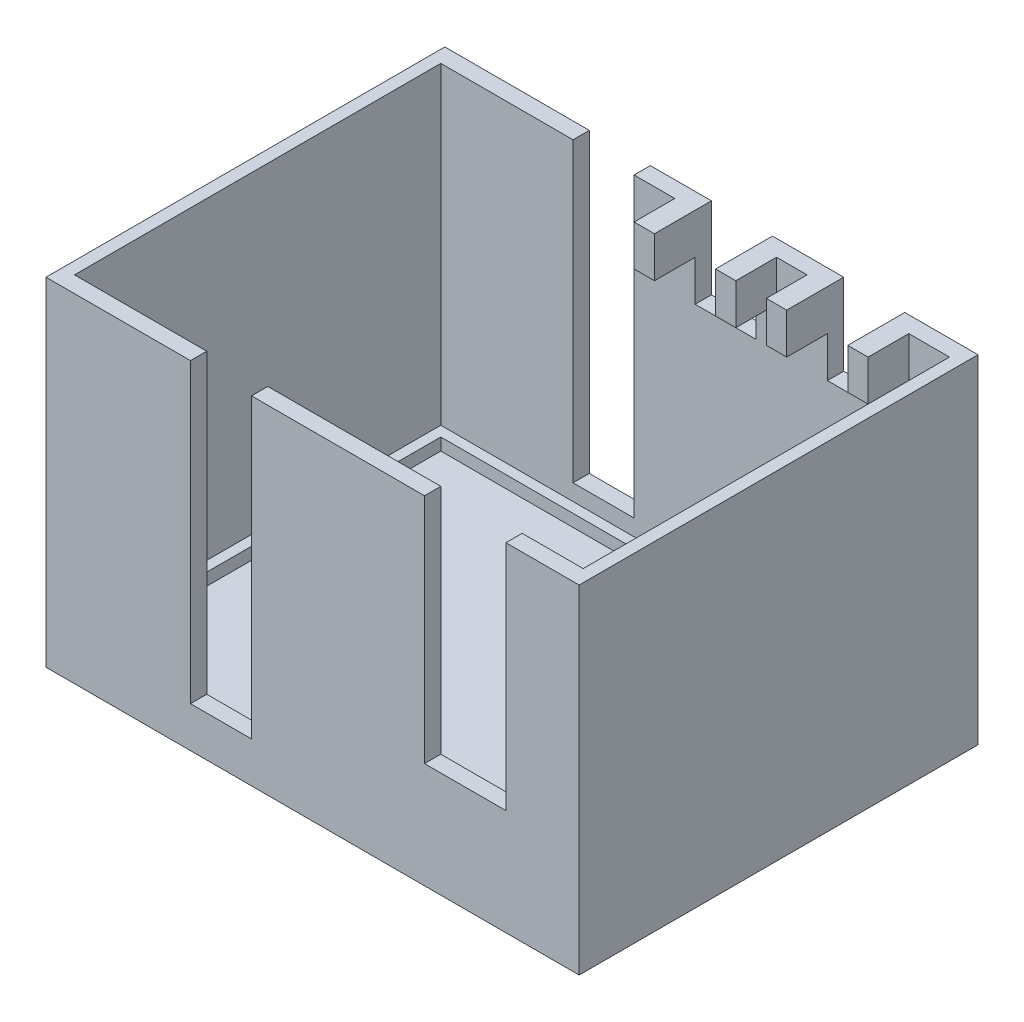
from build123d import *

# Parameters (mm, degrees)
SKETCH1_W           = 131
SKETCH1_H           = 98
SKETCH1_W_2         = 125
SKETCH1_H_2         = 90
BOSS_EXTRUDE1_DEPTH = 80
SKETCH2_W           = 131
SKETCH2_H           = 98
BOSS_EXTRUDE2_DEPTH = 3
SKETCH4_W           = 125
SKETCH4_H           = 90
SKETCH4_W_2         = 119.5
SKETCH4_H_2         = 84.5
BOSS_EXTRUDE3_DEPTH = 3
SKETCH5_W           = 15
SKETCH5_H           = 73
CUT_EXTRUDE1_DEPTH  = 143.457888514
CUT_EXTRUDE2_REACH  = 141.736
SKETCH6_W           = 20
SKETCH6_H           = 57
CUT_EXTRUDE3_REACH  = 141.736
SKETCH7_W           = 15
SKETCH7_H           = 20
SKETCH8_W           = 5
SKETCH8_H           = 10
BOSS_EXTRUDE4_DEPTH = 10


with BuildPart() as part:
    # Sketch1 → Boss-Extrude1 (new body)
    with BuildSketch(Plane(origin=(0, 0, 0), x_dir=(1, 0, 0), z_dir=(0, 1, 0))):
        Rectangle(SKETCH1_W, SKETCH1_H)
        Rectangle(SKETCH1_W_2, SKETCH1_H_2, mode=Mode.SUBTRACT)
    extrude(amount=BOSS_EXTRUDE1_DEPTH)

    # Sketch2 → Boss-Extrude2 (add)
    with BuildSketch(Plane.XZ):
        Rectangle(SKETCH2_W, SKETCH2_H)
    extrude(amount=BOSS_EXTRUDE2_DEPTH)

    # Sketch4 → Boss-Extrude3 (add)
    with BuildSketch(Plane(origin=(0, 0, 0), x_dir=(1, 0, 0), z_dir=(0, 1, 0))):
        Rectangle(SKETCH4_W, SKETCH4_H)
        with Locations((-0.25, 0.25)):
            Rectangle(SKETCH4_W_2, SKETCH4_H_2, mode=Mode.SUBTRACT)
    extrude(amount=BOSS_EXTRUDE3_DEPTH)

    # Sketch5 → Cut-Extrude1 (cut, through all)
    with BuildSketch(Plane(origin=(0, 0, -49), x_dir=(-1, 0, 0), z_dir=(0, 0, -1))):
        with Locations((22.5, 43.5)):
            Rectangle(SKETCH5_W, SKETCH5_H)
    extrude(amount=-CUT_EXTRUDE1_DEPTH, mode=Mode.SUBTRACT)

    # Sketch6 → Cut-Extrude2 (cut, up to next)
    with BuildSketch(Plane(origin=(0, 0, 45), x_dir=(-1, 0, 0), z_dir=(0, 0, -1)), mode=Mode.PRIVATE) as cut_extrude2_sk1:
        with Locations((-37.5, 51.5)):
            Rectangle(SKETCH6_W, SKETCH6_H)
    cut_extrude2_tool1 = extrude(cut_extrude2_sk1.sketch, amount=-CUT_EXTRUDE2_REACH, mode=Mode.PRIVATE) & part.part
    add(cut_extrude2_tool1.solids().sort_by_distance((37.5, 51.5, 45))[0], mode=Mode.SUBTRACT)

    # Sketch7 → Cut-Extrude3 (cut, up to next)
    with BuildSketch(Plane.XY.offset(-45), mode=Mode.PRIVATE) as cut_extrude3_sk1:
        with Locations((40, 70)):
            Rectangle(SKETCH7_W, SKETCH7_H)
    cut_extrude3_tool1 = extrude(cut_extrude3_sk1.sketch, amount=-CUT_EXTRUDE3_REACH, mode=Mode.PRIVATE) & part.part
    # Sketch7 → Cut-Extrude3 (cut, up to next)
    with BuildSketch(Plane.XY.offset(-45), mode=Mode.PRIVATE) as cut_extrude3_sk2:
        with Locations((7.5, 70)):
            Rectangle(SKETCH7_W, SKETCH7_H)
    cut_extrude3_tool2 = extrude(cut_extrude3_sk2.sketch, amount=-CUT_EXTRUDE3_REACH, mode=Mode.PRIVATE) & part.part
    add(cut_extrude3_tool1.solids().sort_by_distance((40, 70, -45))[0], mode=Mode.SUBTRACT)
    add(cut_extrude3_tool2.solids().sort_by_distance((7.5, 70, -45))[0], mode=Mode.SUBTRACT)

    # Sketch8 → Boss-Extrude4 (add)
    with BuildSketch(Plane.XY.offset(-45)):
        with Locations((-2.5, 75)):
            Rectangle(SKETCH8_W, SKETCH8_H)
        with Locations((17.5, 75)):
            Rectangle(SKETCH8_W, SKETCH8_H)
        with Locations((30, 75)):
            Rectangle(SKETCH8_W, SKETCH8_H)
        with Locations((50, 75)):
            Rectangle(SKETCH8_W, SKETCH8_H)
    extrude(amount=BOSS_EXTRUDE4_DEPTH)


solid = part.part
